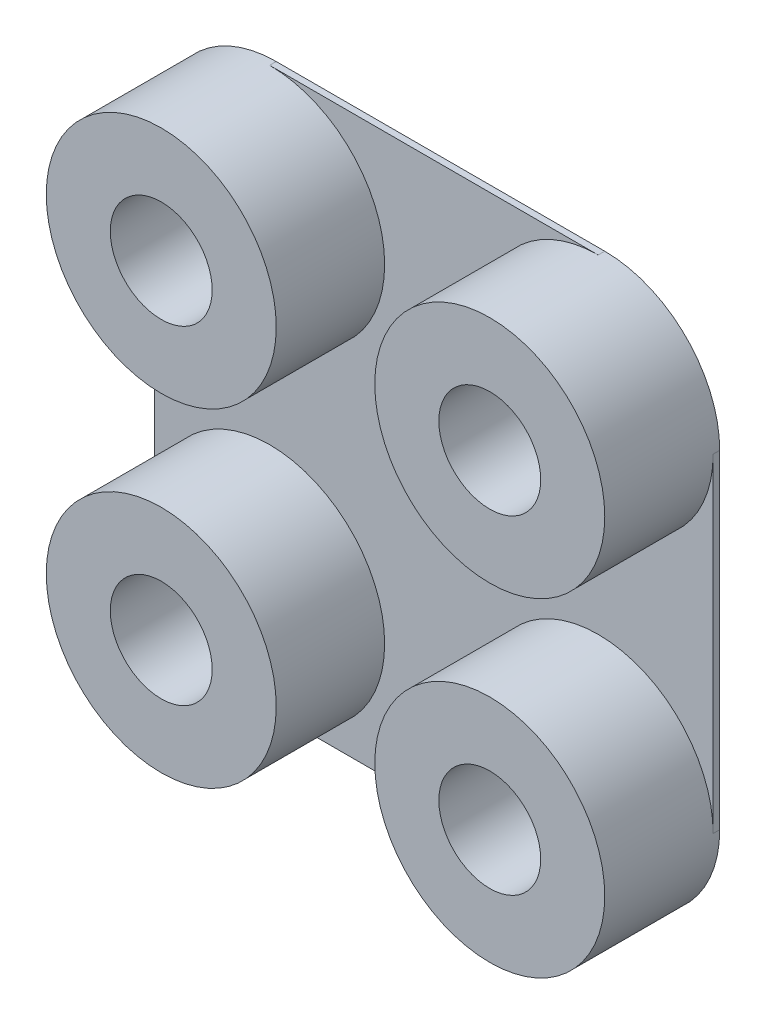
from build123d import *

# Parameters (mm, degrees)
SKETCH1_R             = 3.5
SKETCH1_R_2           = 1.55
BOSS_EXTRUDE1_DEPTH   = 3.5
BOSS_EXTRUDE1_2_DEPTH = 3.5
BOSS_EXTRUDE1_3_DEPTH = 3.5
BOSS_EXTRUDE1_4_DEPTH = 3.5
BOSS_EXTRUDE2_DEPTH   = 0.2


with BuildPart() as part:
    # Sketch1 → Boss-Extrude1 (new body)
    with BuildSketch(Plane.XY):
        Circle(SKETCH1_R)
        Circle(SKETCH1_R_2, mode=Mode.SUBTRACT)
    extrude(amount=BOSS_EXTRUDE1_DEPTH)



with BuildPart() as body_2:
    # Sketch1 → Boss-Extrude1 2 (new body)
    with BuildSketch(Plane.XY):
        with Locations((10, 0)):
            Circle(SKETCH1_R)
        with Locations((10, 0)):
            Circle(SKETCH1_R_2, mode=Mode.SUBTRACT)
    extrude(amount=BOSS_EXTRUDE1_2_DEPTH)


with BuildPart() as body_3:
    # Sketch1 → Boss-Extrude1 3 (new body)
    with BuildSketch(Plane.XY):
        with Locations((10, 10)):
            Circle(SKETCH1_R)
        with Locations((10, 10)):
            Circle(SKETCH1_R_2, mode=Mode.SUBTRACT)
    extrude(amount=BOSS_EXTRUDE1_3_DEPTH)


with BuildPart() as body_4:
    # Sketch1 → Boss-Extrude1 4 (new body)
    with BuildSketch(Plane.XY):
        with Locations((0, 10)):
            Circle(SKETCH1_R)
        with Locations((0, 10)):
            Circle(SKETCH1_R_2, mode=Mode.SUBTRACT)
    extrude(amount=BOSS_EXTRUDE1_4_DEPTH)


with BuildPart() as part_1:
    add(part.part)

    add(body_2.part)  # Boss-Extrude2 merges body 2

    add(body_3.part)  # Boss-Extrude2 merges body 3

    add(body_4.part)  # Boss-Extrude2 merges body 4
    # Sketch2 → Boss-Extrude2 (add)
    with BuildSketch(Plane.XY):
        with BuildLine():
            Line((-3.5, 10), (-3.5, 0))
            ThreePointArc((-3.5, 0), (-2.474873734, -2.474873734), (0, -3.5))
            Line((0, -3.5), (10, -3.5))
            ThreePointArc((10, -3.5), (12.474873734, -2.474873734), (13.5, 0))
            Line((13.5, 0), (13.5, 10))
            ThreePointArc((13.5, 10), (12.474873734, 12.474873734), (10, 13.5))
            Line((10, 13.5), (0, 13.5))
            ThreePointArc((0, 13.5), (-2.474873734, 12.474873734), (-3.5, 10))
        make_face()
    extrude(amount=BOSS_EXTRUDE2_DEPTH)


solid = part_1.part
